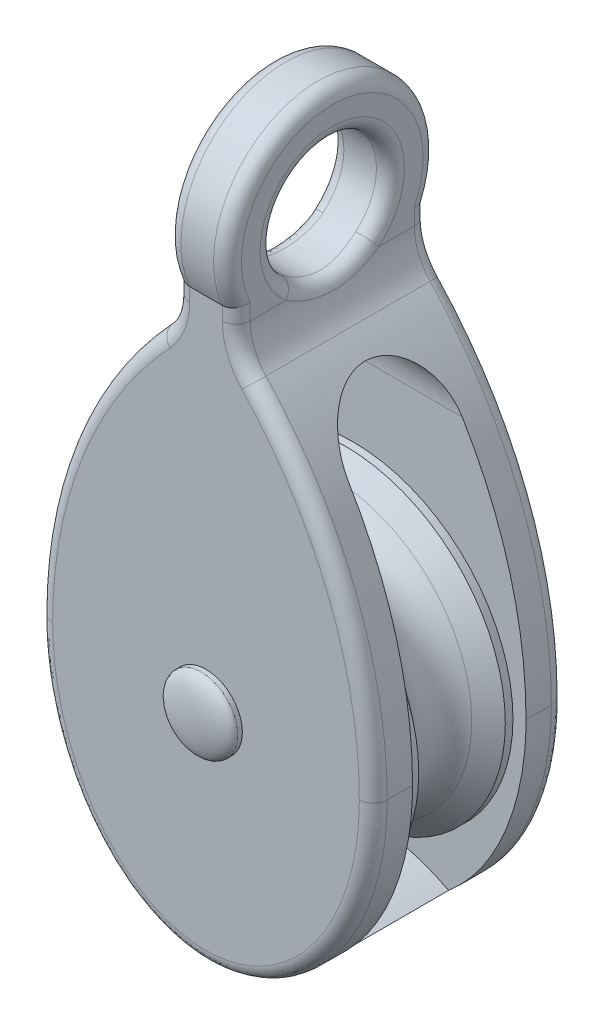
from build123d import *

# Parameters (mm, degrees)
BOSS_EXTRUDE1_DEPTH            = 10.4775
CUT_EXTRUDE1_DEPTH             = 76.2
CUT_EXTRUDE1_DEPTH_BACK        = 76.2
SKETCH4_R                      = 6.35
BOSS_EXTRUDE5_DEPTH            = 3.302
BOSS_EXTRUDE5_DEPTH_BACK       = 3.302
SKETCH20_R                     = 11.43
SKETCH20_R_2                   = 6.35
CUT_EXTRUDE3_DEPTH             = 61.393816508
CUT_EXTRUDE2_REACH             = 61.295
CUT_EXTRUDE2_DIRECTION_2_REACH = 61.295
FILLET2_R                      = 1.524
SKETCH7_R                      = 3.96875
BOSS_EXTRUDE2_DEPTH            = 0.508
DOME1_FACE_RADIUS              = 3.96875
DOME1_HEIGHT                   = 1.27
MIRROR1_COPY_1_FACE_RADIUS     = 3.96875
MIRROR1_COPY_1_HEIGHT          = 1.27
BOSS_EXTRUDE3_REACH            = 63.038
SKETCH8_R                      = 2.38125


with BuildPart() as part:
    # Sketch1 → Revolve1 (revolve)
    with BuildSketch(Plane(origin=(0, 0, 0), x_dir=(0, 0, -1), z_dir=(1, 0, 0))):
        with BuildLine():
            Line((-4.7228125, 17.4625), (-3.083070936, 15.439620119))
            ThreePointArc((-3.083070936, 15.439620119), (0, 13.97), (3.083070936, 15.439620119))
            Line((3.083070936, 15.439620119), (4.7228125, 17.4625))
            Line((4.7228125, 17.4625), (5.55625, 17.4625))
            Line((5.55625, 17.4625), (5.55625, 0))
            Line((5.55625, 0), (-5.55625, 0))
            Line((-5.55625, 0), (-5.55625, 17.4625))
            Line((-5.55625, 17.4625), (-4.7228125, 17.4625))
        make_face()
    revolve(axis=Axis((0, 0, 5.55625), (0, 0, 1)))


with BuildPart() as body_2:
    # Sketch3 → Boss-Extrude1 (new, symmetric)
    with BuildSketch(Plane.XY):
        with BuildLine():
            Line((-3.302, 55.245), (3.302, 55.245))
            Line((3.302, 55.245), (3.302, 37.782019745))
            ThreePointArc((3.302, 37.782019745), (3.747667427, 35.445065131), (5.0221124, 33.436143446))
            ThreePointArc((5.0221124, 33.436143446), (14.827390319, 17.979975574), (18.25625, 0))
            add(Edge.make_bspline(
                [(-18.25625, 0), (-18.25625, -24.13), (0, -24.13), (18.25625, -24.13), (18.25625, 0)],
                knots=[4.71238898, 4.71238898, 4.71238898, 6.283185307, 6.283185307, 7.853981634, 7.853981634, 7.853981634], degree=2, weights=[1, 0.707106781, 1, 0.707106781, 1]))
            ThreePointArc((-18.25625, 0), (-14.827390319, 17.979975574), (-5.0221124, 33.436143446))
            ThreePointArc((-5.0221124, 33.436143446), (-3.747667427, 35.445065131), (-3.302, 37.782019745))
            Line((-3.302, 37.782019745), (-3.302, 55.245))
        make_face()
    extrude(amount=BOSS_EXTRUDE1_DEPTH, both=True)

    # Sketch4 → Cut-Extrude1 (cut, two sides: drawn at the far end of the back side and taken through both)
    with BuildSketch(Plane(origin=(0, 0, 0), x_dir=(0, 0, -1), z_dir=(1, 0, 0)).offset(-CUT_EXTRUDE1_DEPTH_BACK)):
        with Locations(Location((0, 43.815, 0), (0, 0, 251.819010515))):
            Circle(SKETCH4_R)
        with BuildLine():
            Line((-6.19125, 25.130125), (-6.19125, -17.93875))
            Line((-6.19125, -17.93875), (6.19125, -17.93875))
            Line((6.19125, -17.93875), (6.19125, 25.130125))
            ThreePointArc((6.19125, 25.130125), (0, 31.321375), (-6.19125, 25.130125))
        make_face()
    extrude(amount=CUT_EXTRUDE1_DEPTH + CUT_EXTRUDE1_DEPTH_BACK, mode=Mode.SUBTRACT)

    # Sketch20 → Boss-Extrude5 (add, two sides: drawn at the far end of the back side and taken through both)
    with BuildSketch(Plane(origin=(0, 0, 0), x_dir=(0, 0, -1), z_dir=(1, 0, 0)).offset(-BOSS_EXTRUDE5_DEPTH_BACK)):
        with Locations((0, 43.815)):
            Circle(SKETCH20_R)
        with Locations(Location((0, 43.815, 0), (0, 0, 251.819010515))):
            Circle(SKETCH20_R_2, mode=Mode.SUBTRACT)
    extrude(amount=BOSS_EXTRUDE5_DEPTH + BOSS_EXTRUDE5_DEPTH_BACK)

    # Sketch21 → Cut-Extrude3 (cut, through all)
    with BuildSketch(Plane.ZY.offset(3.302)):
        with BuildLine():
            Line((-11.43, 43.815), (-13.97, 43.815))
            Line((-13.97, 43.815), (-13.97, 57.785))
            Line((-13.97, 57.785), (13.97, 57.785))
            Line((13.97, 57.785), (13.97, 43.815))
            Line((13.97, 43.815), (11.43, 43.815))
            ThreePointArc((11.43, 43.815), (0, 55.245), (-11.43, 43.815))
        make_face()
    extrude(amount=-CUT_EXTRUDE3_DEPTH, mode=Mode.SUBTRACT)

    # Cut-Extrude2: up to this face of the body (flat: up to its plane)
    cut_extrude2_end = Plane(body_2.part.faces().sort_by_distance((0, 3.174717718, -6.19125))[0])
    # Sketch6 → Cut-Extrude2 (cut, up to the picked face)
    with BuildSketch(Plane.XY, mode=Mode.PRIVATE) as cut_extrude2_sk1:
        with BuildLine():
            Line((-13.200290139, -16.66875), (13.200290139, -16.66875))
            add(Edge.make_bspline(
                [(9.808227493, -20.35175), (11.672989205, -18.781735693), (13.200290139, -16.66875)],
                knots=[0.567176902, 0.567176902, 0.567176902, 0.808215986, 0.808215986, 0.808215986], degree=2, weights=[1, 0.992746306, 1]))
            ThreePointArc((9.808227493, -20.35175), (0, -17.93875), (-9.808227493, -20.35175))
            add(Edge.make_bspline(
                [(-13.200290139, -16.66875), (-11.672989205, -18.781735693), (-9.808227493, -20.35175)],
                knots=[5.474969321, 5.474969321, 5.474969321, 5.716008406, 5.716008406, 5.716008406], degree=2, weights=[1, 0.992746306, 1]))
        make_face()
    cut_extrude2_tool1 = split(extrude(cut_extrude2_sk1.sketch, amount=-CUT_EXTRUDE2_REACH, mode=Mode.PRIVATE), bisect_by=cut_extrude2_end, keep=Keep.BOTH, mode=Mode.PRIVATE)
    add(cut_extrude2_tool1.solids().sort_by(Axis((0, -17.851852, 0), (0, 0, -1)))[0], mode=Mode.SUBTRACT)

    # Cut-Extrude2 direction 2: up to this face of the body (flat: up to its plane)
    cut_extrude2_direction_2_end = Plane(body_2.part.faces().sort_by_distance((0, 3.174717817, 6.19125))[0])
    # Sketch6 → Cut-Extrude2 direction 2 (cut, up to the picked face)
    with BuildSketch(Plane.XY, mode=Mode.PRIVATE) as cut_extrude2_direction_2_sk1:
        with BuildLine():
            Line((-13.200290139, -16.66875), (13.200290139, -16.66875))
            add(Edge.make_bspline(
                [(9.808227493, -20.35175), (11.672989205, -18.781735693), (13.200290139, -16.66875)],
                knots=[0.567176902, 0.567176902, 0.567176902, 0.808215986, 0.808215986, 0.808215986], degree=2, weights=[1, 0.992746306, 1]))
            ThreePointArc((9.808227493, -20.35175), (0, -17.93875), (-9.808227493, -20.35175))
            add(Edge.make_bspline(
                [(-13.200290139, -16.66875), (-11.672989205, -18.781735693), (-9.808227493, -20.35175)],
                knots=[5.474969321, 5.474969321, 5.474969321, 5.716008406, 5.716008406, 5.716008406], degree=2, weights=[1, 0.992746306, 1]))
        make_face()
    cut_extrude2_direction_2_tool1 = split(extrude(cut_extrude2_direction_2_sk1.sketch, amount=CUT_EXTRUDE2_DIRECTION_2_REACH, mode=Mode.PRIVATE), bisect_by=cut_extrude2_direction_2_end, keep=Keep.BOTH, mode=Mode.PRIVATE)
    add(cut_extrude2_direction_2_tool1.solids().sort_by(Axis((0, -17.851852, 0), (0, 0, 1)))[0], mode=Mode.SUBTRACT)

    # Fillet2
    fillet2_edges = [body_2.edges().sort_by_distance(p)[0] for p in [
        (-14.827390319, 17.979975574, -10.4775),
        (0, -24.13, -10.4775),
        (-14.827390319, 17.979975574, 10.4775),
        (0, -24.13, 10.4775),
        (14.827390319, 17.979975574, -10.4775),
        (14.827390319, 17.979975574, 10.4775),
        (3.309918443, 37.465, 0),
        (-3.309918443, 37.465, 0),
        (-3.302, 38.514495109, -10.4775),
        (3.302, 38.514495109, 10.4775),
        (3.302, 38.514495109, -10.4775),
        (-3.302, 38.514495109, 10.4775),
        (-3.302, 55.245, 0),
        (3.302, 55.245, 0),
        (-3.747667427, 35.445065131, -10.4775),
        (3.747667427, 35.445065131, -10.4775),
        (-3.747667427, 35.445065131, 10.4775),
        (3.747667427, 35.445065131, 10.4775),
        (-3.309918443, 37.465, 0),
        (3.309918443, 37.465, 0),
    ]]
    fillet(fillet2_edges, radius=FILLET2_R)

    # Sketch7 → Boss-Extrude2 (add)
    with BuildSketch(Plane(origin=(0, 0, -10.4775), x_dir=(-1, 0, 0), z_dir=(0, 0, -1))):
        with Locations(Location((0, 0, 0), (0, 0, 180))):
            Circle(SKETCH7_R)
    boss_extrude2 = extrude(amount=BOSS_EXTRUDE2_DEPTH)

    # Dome1: an elliptical dome of height H over a round flat face of radius A is half a spheroid: the quarter ellipse of half axes A and H revolved about the face's axis
    with BuildSketch(Plane((0, 0, -10.9855), x_dir=(0, -1, 0), z_dir=(1, 0, 0)), mode=Mode.PRIVATE) as dome1_quarter:
        Ellipse(DOME1_FACE_RADIUS, DOME1_HEIGHT)
        Rectangle(DOME1_FACE_RADIUS, DOME1_HEIGHT, align=(Align.MIN, Align.MIN), mode=Mode.INTERSECT)
    revolve(dome1_quarter.sketch, axis=Axis((0, 0, -10.9855), (0, 0, -1)))

    # Mirror1: Boss-Extrude2 across plane
    add(boss_extrude2.mirror(Plane.XY))

    # Mirror1 copy 1: an elliptical dome of height H over a round flat face of radius A is half a spheroid: the quarter ellipse of half axes A and H revolved about the face's axis
    with BuildSketch(Plane((0, 0, 10.9855), x_dir=(0, 1, 0), z_dir=(1, 0, 0)), mode=Mode.PRIVATE) as mirror1_copy_1_quarter:
        Ellipse(MIRROR1_COPY_1_FACE_RADIUS, MIRROR1_COPY_1_HEIGHT)
        Rectangle(MIRROR1_COPY_1_FACE_RADIUS, MIRROR1_COPY_1_HEIGHT, align=(Align.MIN, Align.MIN), mode=Mode.INTERSECT)
    revolve(mirror1_copy_1_quarter.sketch, axis=Axis((0, 0, 10.9855), (0, 0, 1)))

    # Boss-Extrude3: up to this face of the body (flat: up to its plane)
    boss_extrude3_end = Plane(body_2.part.faces().sort_by_distance((0, 2.841963151, 6.19125))[0])
    # Sketch8 → Boss-Extrude3 (add, up to the picked face)
    with BuildSketch(Plane.XY.offset(-6.19125), mode=Mode.PRIVATE) as boss_extrude3_sk1:
        with Locations(Location((0, 0, 0), (0, 0, 90))):
            Circle(SKETCH8_R)
    boss_extrude3_tool1 = split(extrude(boss_extrude3_sk1.sketch, amount=BOSS_EXTRUDE3_REACH, mode=Mode.PRIVATE), bisect_by=boss_extrude3_end, keep=Keep.BOTH, mode=Mode.PRIVATE)

    add(part.part)  # Boss-Extrude3 merges part
    add(boss_extrude3_tool1.solids().sort_by(Axis((0, 0, -6.19125), (0, 0, 1)))[0])


solid = body_2.part
